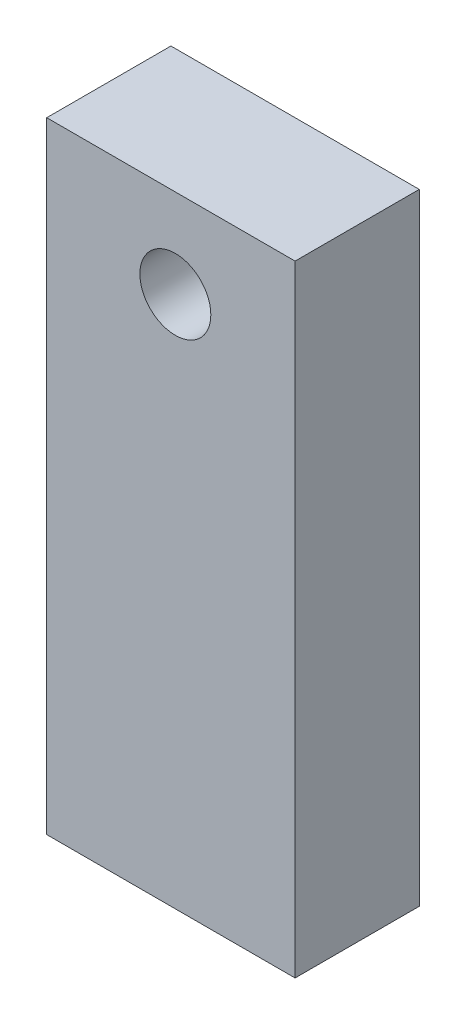
from build123d import *

# Parameters (mm, degrees)
SKETCH_1_W          = 28
SKETCH_1_H          = 14
EXTRUDE_1_DEPTH     = 70
SKETCH_2_R          = 4
CUT_EXTRUDE_2_DEPTH = 77.681158051


with BuildPart() as part:
    # Эскиз1 → Вытянуть1 (new body)
    with BuildSketch(Plane(origin=(0, 0, 0), x_dir=(1, 0, 0), z_dir=(0, 1, 0))):
        with Locations((14, -7)):
            Rectangle(SKETCH_1_W, SKETCH_1_H)
    extrude(amount=EXTRUDE_1_DEPTH)

    # Эскиз2 → Вытянуть2 (cut, through all)
    with BuildSketch(Plane.XY.offset(14)):
        with Locations((14.5, 60)):
            Circle(SKETCH_2_R)
    extrude(amount=-CUT_EXTRUDE_2_DEPTH, mode=Mode.SUBTRACT)


solid = part.part
